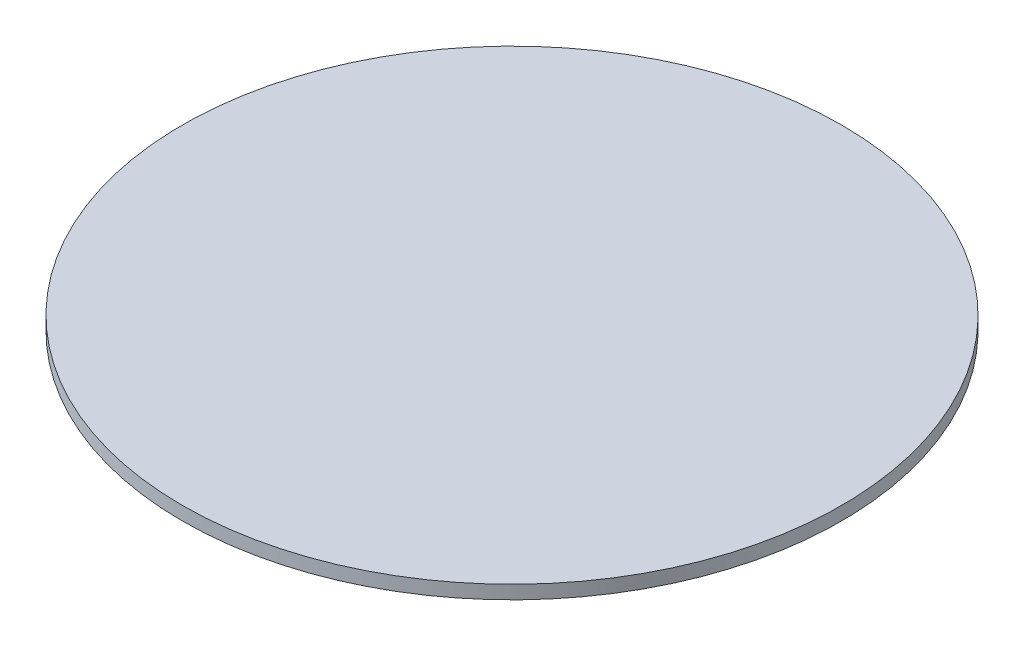
from build123d import *

# Parameters (mm, degrees)
SKETCH1_R           = 73.2
BOSS_EXTRUDE1_DEPTH = 3


with BuildPart() as part:
    # Sketch1 → Boss-Extrude1 (new body)
    with BuildSketch(Plane(origin=(0, 0, 0), x_dir=(1, 0, 0), z_dir=(0, 1, 0))):
        with Locations(Location((0, 0, 0), (0, 0, 270))):
            Circle(SKETCH1_R)
    extrude(amount=BOSS_EXTRUDE1_DEPTH)


solid = part.part
